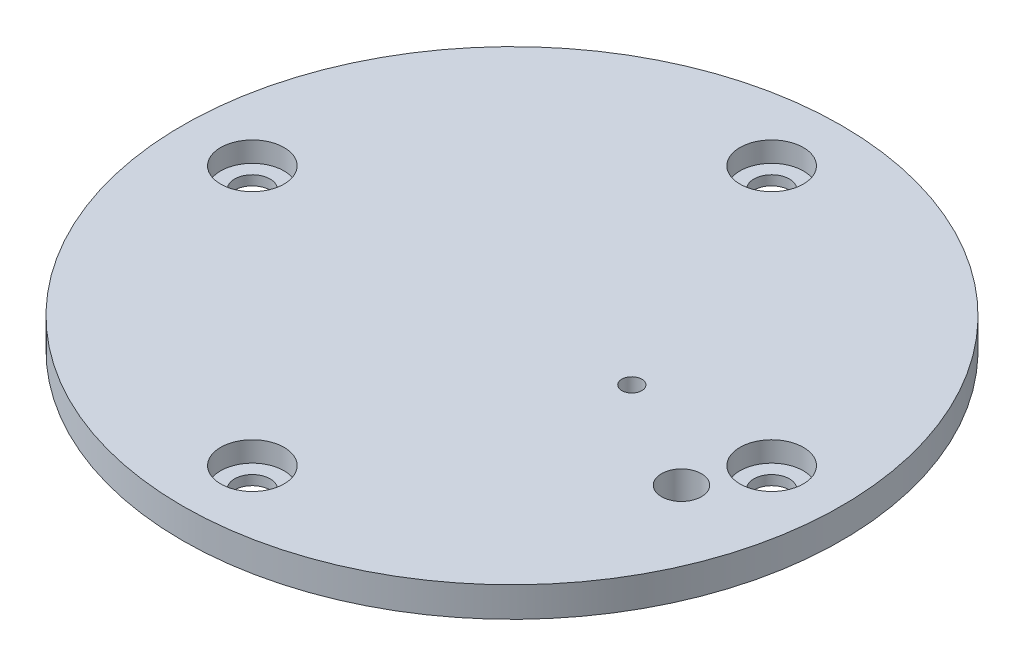
from build123d import *

# Parameters (mm, degrees)
SKETCH1_R                                      = 16.5
BOSS_EXTRUDE1_DEPTH                            = 1.5
CBORE_FOR_0_SOCKET_HEAD_CAP_SCREW1_D           = 1.778
CBORE_FOR_0_SOCKET_HEAD_CAP_SCREW1_CBORE_D     = 3.175
CBORE_FOR_0_SOCKET_HEAD_CAP_SCREW1_CBORE_DEPTH = 1.016
CIRPATTERN1_COUNT                              = 4
SKETCH8_R                                      = 0.5
CUT_EXTRUDE1_DEPTH                             = 1.5
SKETCH9_R                                      = 1
CUT_EXTRUDE2_DEPTH                             = 10


with BuildPart() as part:
    # Sketch1 → Boss-Extrude1 (new body)
    with BuildSketch(Plane(origin=(0, 0, 0), x_dir=(1, 0, 0), z_dir=(0, 1, 0))):
        with Locations(Location((0, 0, 0), (0, 0, 270))):
            Circle(SKETCH1_R)
    extrude(amount=BOSS_EXTRUDE1_DEPTH)

    # CBORE for #0 Socket Head Cap Screw1 (through all)
    with Locations(Plane(origin=(0, 1.5, 0), x_dir=(1, 0, 0), z_dir=(0, 1, 0))):
        with Locations((13, 0)):
            cbore_for_0_socket_head_cap_screw1 = CounterBoreHole(CBORE_FOR_0_SOCKET_HEAD_CAP_SCREW1_D / 2, CBORE_FOR_0_SOCKET_HEAD_CAP_SCREW1_CBORE_D / 2, CBORE_FOR_0_SOCKET_HEAD_CAP_SCREW1_CBORE_DEPTH)

    # CirPattern1: CBORE for #0 Socket Head Cap Screw1 ×4 about axis
    cirpattern1_axis = Axis((0, 0, 0), (0, 1, 0))
    for i in range(1, CIRPATTERN1_COUNT):
        add(cbore_for_0_socket_head_cap_screw1.rotate(cirpattern1_axis, i * 360 / CIRPATTERN1_COUNT), mode=Mode.SUBTRACT)

    # Sketch8 → Cut-Extrude1 (cut)
    with BuildSketch(Plane.XZ):
        with Locations(Location((6, 0, 0), (0, 0, 270))):
            Circle(SKETCH8_R)
    extrude(amount=-CUT_EXTRUDE1_DEPTH, mode=Mode.SUBTRACT)

    # Sketch9 → Cut-Extrude2 (cut)
    with BuildSketch(Plane(origin=(0, 1.5, 0), x_dir=(1, 0, 0), z_dir=(0, 1, 0))):
        with Locations(Location((11.591109915, -3.105828541, 0), (0, 0, 270))):
            Circle(SKETCH9_R)
    extrude(amount=-CUT_EXTRUDE2_DEPTH, mode=Mode.SUBTRACT)


solid = part.part
